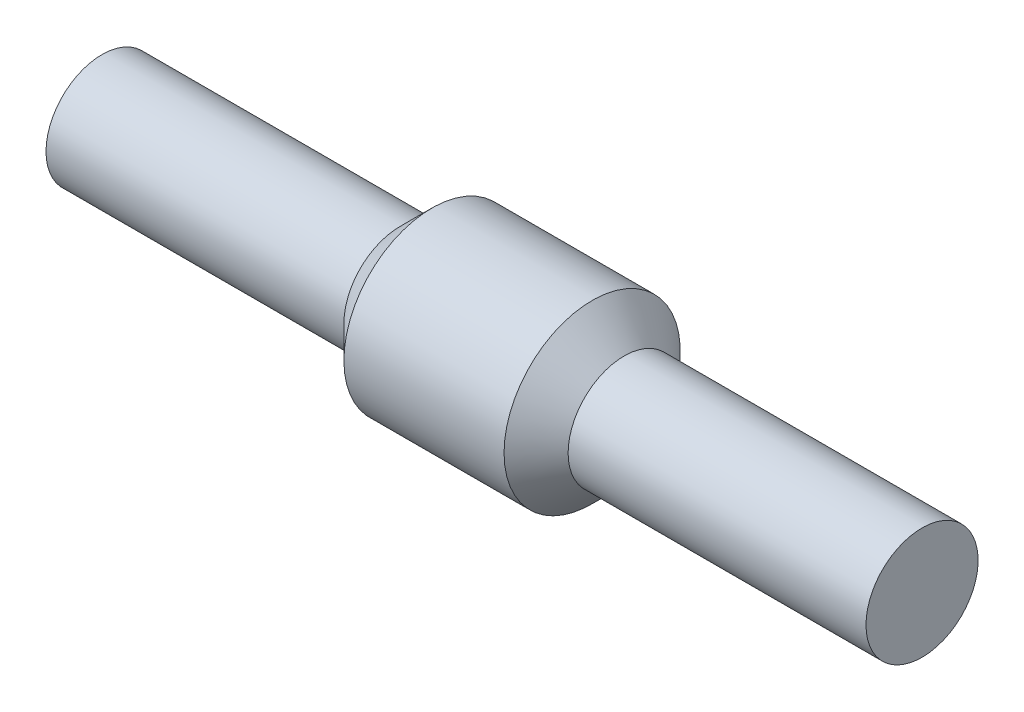
from build123d import *


with BuildPart() as part:
    # Sketch2 → Revolve1 (revolve)
    with BuildSketch(Plane.XY, mode=Mode.PRIVATE) as revolve1_sk:
        Polygon((12.8, 0), (12.8, 1.75), (3.5, 1.75), (2.5, 2.75), (0, 2.75), (0, 0), align=None)
    revolve1 = revolve(revolve1_sk.sketch.rotate(Axis((-20, 0, 0), (1, 0, 0)), 90), axis=Axis((-20, 0, 0), (1, 0, 0)))

    # Mirror1: Revolve1 across plane
    add(revolve1.mirror(Plane(origin=(0, 0, 0), x_dir=(0, 0, 1), z_dir=(1, 0, 0))))


solid = part.part
